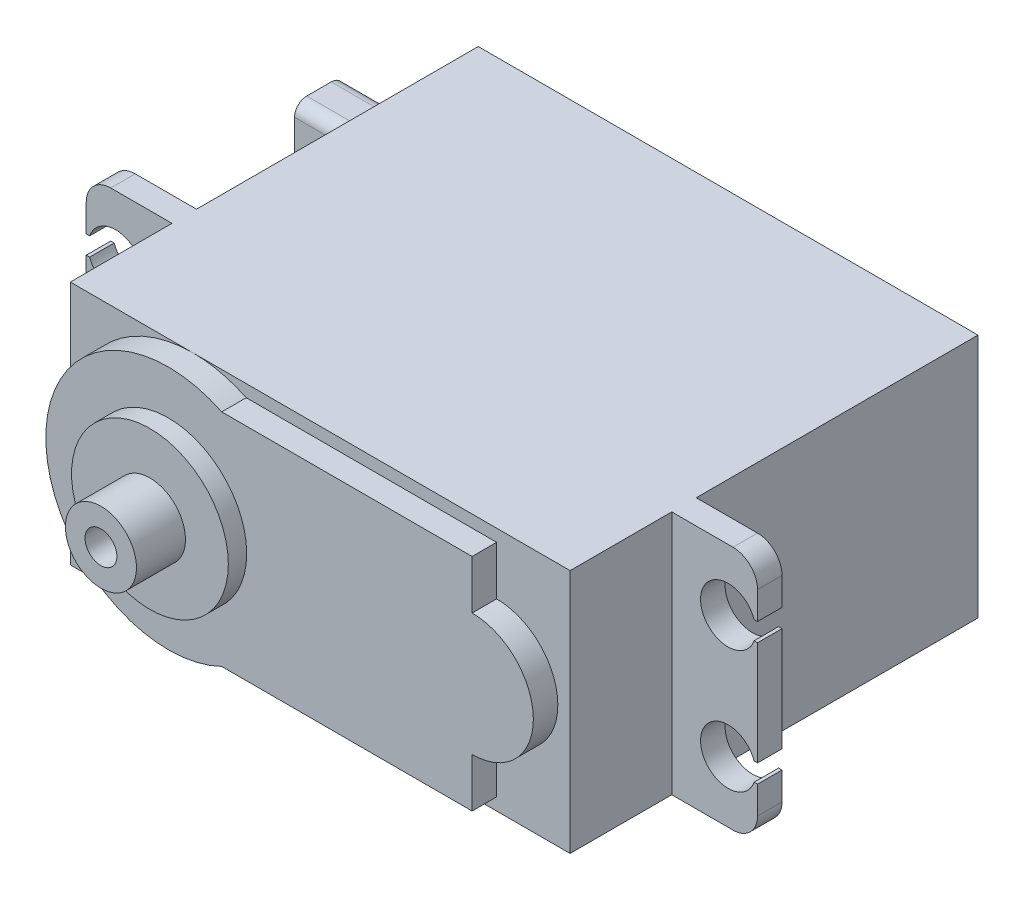
from build123d import *

# Parameters (mm, degrees)
ESQUISSE1_W             = 40.8
ESQUISSE1_H             = 20
BOSS_EXTRU_1_DEPTH      = 35.3
BOSS_EXTRU_2_DEPTH      = 2
ESQUISSE3_R             = 6.4
BOSS_EXTRU_3_DEPTH      = 1.5
ESQUISSE4_R             = 2.9
ESQUISSE4_R_2           = 1.3
BOSS_EXTRU_4_DEPTH      = 4
ESQUISSE5_W             = 7
ESQUISSE5_H             = 20
BOSS_EXTRU_5_DEPTH      = 2
ENL_V_MAT_EXTRU_1_DEPTH = 59.428075443
CONG_1_R                = 2
ESQUISSE7_W             = 4
ESQUISSE7_H             = 7
BOSS_EXTRU_6_DEPTH      = 10
CHANFREIN1_SIZE         = 2
CONG_2_R                = 1


with BuildPart() as part:
    # Esquisse1 → Boss.-Extru.1 (new body)
    with BuildSketch(Plane.XY):
        with Locations((20.4, 10)):
            Rectangle(ESQUISSE1_W, ESQUISSE1_H)
    extrude(amount=BOSS_EXTRU_1_DEPTH)

    # Esquisse2 → Boss.-Extru.2 (add)
    with BuildSketch(Plane.XY.offset(35.3)):
        with BuildLine():
            Line((14.358898944, 19), (34.8, 19))
            Line((34.8, 19), (34.8, 15))
            ThreePointArc((34.8, 15), (39.8, 10), (34.8, 5))
            Line((34.8, 5), (34.8, 1))
            Line((34.8, 1), (14.358898944, 1))
            ThreePointArc((14.358898944, 1), (0, 10), (14.358898944, 19))
        make_face()
    extrude(amount=BOSS_EXTRU_2_DEPTH)

    # Esquisse3 → Boss.-Extru.3 (add)
    with BuildSketch(Plane.XY.offset(37.3)):
        with Locations((10, 10)):
            Circle(ESQUISSE3_R)
    extrude(amount=BOSS_EXTRU_3_DEPTH)

    # Esquisse4 → Boss.-Extru.4 (add)
    with BuildSketch(Plane.XY.offset(38.8)):
        with Locations((10, 10)):
            Circle(ESQUISSE4_R)
        with Locations((10, 10)):
            Circle(ESQUISSE4_R_2, mode=Mode.SUBTRACT)
    extrude(amount=BOSS_EXTRU_4_DEPTH)

    # Esquisse5 → Boss.-Extru.5 (add)
    with BuildSketch(Plane(origin=(0, 0, 27), x_dir=(-1, 0, 0), z_dir=(0, 0, -1))):
        with Locations((-44.3, 10)):
            Rectangle(ESQUISSE5_W, ESQUISSE5_H)
        with Locations((3.5, 10)):
            Rectangle(ESQUISSE5_W, ESQUISSE5_H)
    extrude(amount=BOSS_EXTRU_5_DEPTH)

    # Esquisse6 → Enlèv. mat.-Extru.1 (cut, through all)
    with BuildSketch(Plane.XY.offset(27)):
        with BuildLine():
            Line((-6.721320344, 15.75), (-7, 15.75))
            Line((-7, 15.75), (-7, 14.25))
            Line((-7, 14.25), (-6.721320344, 14.25))
            ThreePointArc((-6.721320344, 14.25), (-2.35, 15), (-6.721320344, 15.75))
        make_face()
        with BuildLine():
            Line((47.521320344, 14.25), (47.8, 14.25))
            Line((47.8, 14.25), (47.8, 15.75))
            Line((47.8, 15.75), (47.521320344, 15.75))
            ThreePointArc((47.521320344, 15.75), (43.15, 15), (47.521320344, 14.25))
        make_face()
        with BuildLine():
            Line((47.521320344, 4.25), (47.8, 4.25))
            Line((47.8, 4.25), (47.8, 5.75))
            Line((47.8, 5.75), (47.521320344, 5.75))
            ThreePointArc((47.521320344, 5.75), (43.15, 5), (47.521320344, 4.25))
        make_face()
        with BuildLine():
            Line((-6.721320344, 5.75), (-7, 5.75))
            Line((-7, 5.75), (-7, 4.25))
            Line((-7, 4.25), (-6.721320344, 4.25))
            ThreePointArc((-6.721320344, 4.25), (-2.35, 5), (-6.721320344, 5.75))
        make_face()
    extrude(amount=-ENL_V_MAT_EXTRU_1_DEPTH, mode=Mode.SUBTRACT)

    # Congé1
    cong_1_edges = [part.edges().sort_by_distance(p)[0] for p in [
        (47.8, 20, 26),
        (47.8, 0, 26),
        (-7, 20, 26),
        (-7, 0, 26),
    ]]
    fillet(cong_1_edges, radius=CONG_1_R)

    # Esquisse7 → Boss.-Extru.6 (add)
    with BuildSketch(Plane.ZY):
        with Locations((5, 10)):
            Rectangle(ESQUISSE7_W, ESQUISSE7_H)
    extrude(amount=BOSS_EXTRU_6_DEPTH)

    # Chanfrein1
    chanfrein1_edges = [part.edges().sort_by_distance(p)[0] for p in [
        (20.4, 20, 0),
        (40.8, 10, 0),
        (20.4, 0, 0),
        (0, 10, 0),
    ]]
    chamfer(chanfrein1_edges, length=CHANFREIN1_SIZE)

    # Congé2
    cong_2_edges = [part.edges().sort_by_distance(p)[0] for p in [
        (-5, 6.5, 7),
        (-5, 13.5, 7),
        (-5, 13.5, 3),
        (-5, 6.5, 3),
    ]]
    fillet(cong_2_edges, radius=CONG_2_R)


solid = part.part
